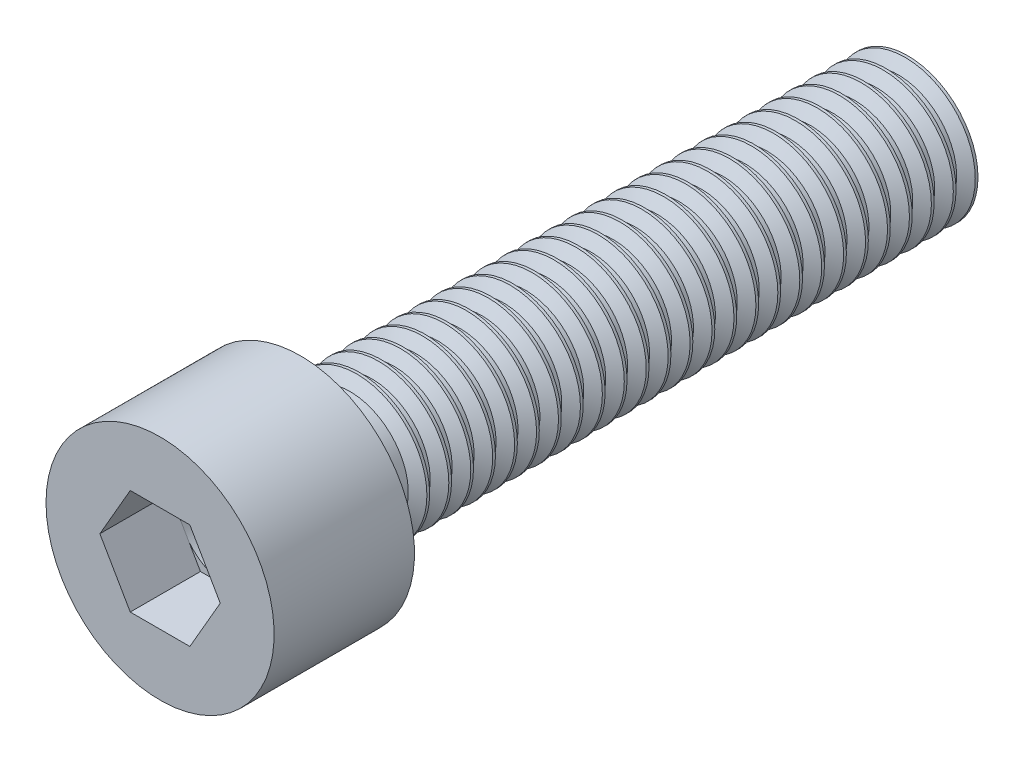
from build123d import *

# Parameters (mm, degrees)
SKETCH1_R          = 3.32812519
BASE_EXTRUDE_DEPTH = 35
LPATTERN1_COUNT    = 26
LPATTERN1_PITCH    = 1.249999972
SKETCH7_W          = 6.500000134
SKETCH7_H          = 8.00000038
CUT_EXTRUDE2_DEPTH = 4.00000019


with BuildPart() as part:
    # Sketch1 → Base-Extrude (new body)
    with BuildSketch(Plane.XY):
        Circle(SKETCH1_R)
    extrude(amount=BASE_EXTRUDE_DEPTH)

    # Boss-Sweep1: sweep along a path in Sketch4
    with BuildLine(Plane(origin=(0, 0, 0.5), x_dir=(-1, 0, 0), z_dir=(0, 0, -1))) as boss_sweep1_path:
        CenterArc((0, 0), 3.32812519, 0, 360)
    # Sketch2 → Boss-Sweep1 (sweep)
    with BuildSketch(Plane(origin=(0, 0, 0), x_dir=(1, 0, 0), z_dir=(0, 1, 0))):
        Polygon((3.32812519, 0), (4.00000019, -0.387907212), (4.00000019, -0.544157209), (3.32812519, -0.932064421), align=None)
    boss_sweep1 = sweep(path=boss_sweep1_path.line)

    # LPattern1: Boss-Sweep1 ×26
    with Locations(*[(0, 0, i * LPATTERN1_PITCH) for i in range(1, LPATTERN1_COUNT)]):
        add(boss_sweep1)

    # Sketch7 → Boss-Revolve2 (revolve)
    with BuildSketch(Plane(origin=(0, 0, 0), x_dir=(1, 0, 0), z_dir=(0, 1, 0))):
        with Locations((3.250000067, -39.00000019)):
            Rectangle(SKETCH7_W, SKETCH7_H)
    revolve(axis=Axis((0, 0, 0), (0, 0, 1)))

    # Sketch8 → Cut-Extrude2 (cut)
    with BuildSketch(Plane.XY.offset(43.00000038)):
        Polygon((-1.697949218, 3.000000026), (1.697949218, 3.000000026), (3.430000041, 0), (1.697949218, -3.000000026), (-1.697949218, -3.000000026), (-3.430000041, 0), align=None)
    extrude(amount=-CUT_EXTRUDE2_DEPTH, mode=Mode.SUBTRACT)

    # Sketch9 → Cut-Revolve1 (revolve, cut)
    with BuildSketch(Plane(origin=(0, 0, 0), x_dir=(1, 0, 0), z_dir=(0, 1, 0))):
        Polygon((0, -39.00000019), (3.000000026, -39.00000019), (3.000000026, -38.20000021), (0, -37.396152626), align=None)
    revolve(axis=Axis((0, 0, 0), (0, 0, 1)), mode=Mode.SUBTRACT)


solid = part.part
